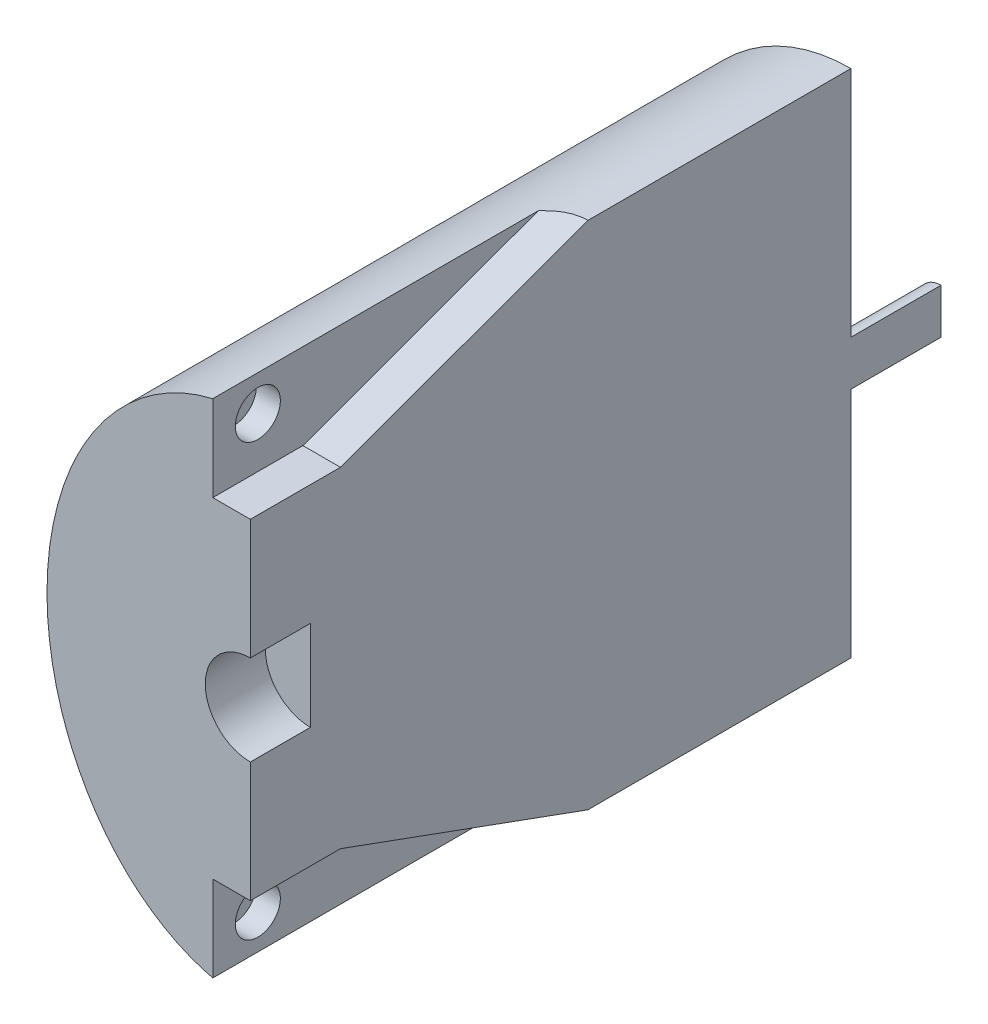
from build123d import *

# Parameters (mm, degrees)
CROQUIS1_RX             = 85
CROQUIS1_RY             = 67.73101263
SALIENTE_EXTRUIR1_DEPTH = 200
CORTAR_EXTRUIR1_DEPTH   = 100
SALIENTE_EXTRUIR2_DEPTH = 30
CROQUIS5_R              = 7.5
SALIENTE_EXTRUIR3_DEPTH = 30
CORTAR_EXTRUIR3_DEPTH   = 30
CROQUIS8_W              = 83.299216536
CROQUIS8_H              = 210.979163193
CORTAR_EXTRUIR4_DEPTH   = 348.816388214
CROQUIS9_R              = 15
CORTAR_EXTRUIR5_DEPTH   = 20
CROQUIS10_R             = 7.5
CORTAR_EXTRUIR6_DEPTH   = 8
CORTAR_EXTRUIR7_DEPTH   = 12.5


with BuildPart() as part:
    # Croquis1 → Saliente-Extruir1 (new body)
    with BuildSketch(Plane.XY):
        with Locations(Location((-119.067557665, 97.160736636), (0, 0, 90))):
            Ellipse(CROQUIS1_RX, CROQUIS1_RY)
    extrude(amount=SALIENTE_EXTRUIR1_DEPTH)

    # Croquis3 → Cortar-Extruir1 (cut)
    with BuildSketch(Plane.XY.offset(200)):
        with BuildLine():
            Line((-171.829854236, 137.159885706), (-171.829854236, 57.159885706))
            Line((-171.829854236, 57.159885706), (-178.829854236, 57.159885706))
            add(Edge.make_bspline(
                [(-178.830577491, 137.159885706), (-195.829371976, 97.159643663), (-178.829854236, 57.159885706)],
                knots=[1.080850346, 1.080850346, 1.080850346, 2.060764999, 2.060764999, 2.060764999], degree=2, weights=[1, 0.882352941, 1]))
            Line((-178.830577491, 137.159885706), (-171.829854236, 137.159885706))
        make_face()
    extrude(amount=-CORTAR_EXTRUIR1_DEPTH, mode=Mode.SUBTRACT)

    # Croquis4 → Saliente-Extruir2 (add)
    with BuildSketch(Plane.XY.offset(200)):
        with BuildLine():
            Line((-178.830577491, 137.159885706), (-171.829854236, 137.159885706))
            Line((-171.829854236, 137.159885706), (-171.829854236, 57.159885706))
            Line((-171.829854236, 57.159885706), (-178.829854236, 57.159885706))
            add(Edge.make_bspline(
                [(-178.830577491, 137.159885706), (-195.797797403, 97.186782087), (-178.829854236, 57.159885706)],
                knots=[4.219557052, 4.219557052, 4.219557052, 5.198274326, 5.198274326, 5.198274326], degree=2, weights=[1, 0.882634519, 1]))
        make_face()
    extrude(amount=-SALIENTE_EXTRUIR2_DEPTH)

    # Croquis5 → Saliente-Extruir3 (add)
    with BuildSketch(Plane(origin=(0, 0, 0), x_dir=(-1, 0, 0), z_dir=(0, 0, -1))):
        with Locations(Location((119.067557665, 97.160736636, 0), (0, 0, 180))):
            Circle(CROQUIS5_R)
    extrude(amount=SALIENTE_EXTRUIR3_DEPTH)

    # Croquis7 → Cortar-Extruir3 (cut)
    with BuildSketch(Plane.XY.offset(200)):
        with BuildLine():
            Line((-131.567557665, 42.160736636), (-106.567557665, 42.160736636))
            Line((-106.567557665, 42.160736636), (-106.567557665, 13.620827843))
            add(Edge.make_bspline(
                [(-131.567557665, 13.620827843), (-119.067557665, 10.675126293), (-106.567557665, 13.620827843)],
                knots=[6.0975677, 6.0975677, 6.0975677, 6.468802915, 6.468802915, 6.468802915], degree=2, weights=[1, 0.982822456, 1]))
            Line((-131.567557665, 13.620827843), (-131.567557665, 42.160736636))
        make_face()
        with BuildLine():
            Line((-131.567557665, 180.700645429), (-131.567557665, 152.160736636))
            Line((-131.567557665, 152.160736636), (-106.567557665, 152.160736636))
            Line((-106.567557665, 152.160736636), (-106.567557665, 180.700645429))
            add(Edge.make_bspline(
                [(-106.567557665, 180.700645429), (-119.067557665, 183.64634698), (-131.567557665, 180.700645429)],
                knots=[2.955975046, 2.955975046, 2.955975046, 3.327210261, 3.327210261, 3.327210261], degree=2, weights=[1, 0.982822456, 1]))
        make_face()
    extrude(amount=-CORTAR_EXTRUIR3_DEPTH, mode=Mode.SUBTRACT)

    # Croquis8 → Cortar-Extruir4 (cut, through all)
    with BuildSketch(Plane.XY.offset(200)):
        with Locations((-77.417949397, 96.990041521)):
            Rectangle(CROQUIS8_W, CROQUIS8_H)
    extrude(amount=-CORTAR_EXTRUIR4_DEPTH, mode=Mode.SUBTRACT)

    # Croquis9 → Cortar-Extruir5 (cut)
    with BuildSketch(Plane.XY.offset(200)):
        with Locations((-119.067557665, 97.160736636)):
            Circle(CROQUIS9_R)
    extrude(amount=-CORTAR_EXTRUIR5_DEPTH, mode=Mode.SUBTRACT)

    # Croquis10 → Cortar-Extruir6 (cut)
    with BuildSketch(Plane(origin=(-131.567557665, 0, 0), x_dir=(0, 0, -1), z_dir=(1, 0, 0))):
        with Locations((-185, 168.930691033)):
            Circle(CROQUIS10_R)
        with Locations((-185, 25.39078224)):
            Circle(CROQUIS10_R)
    extrude(amount=-CORTAR_EXTRUIR6_DEPTH, mode=Mode.SUBTRACT)

    # Croquis11 → Cortar-Extruir7 (cut)
    with BuildSketch(Plane(origin=(-119.067557665, 0, 0), x_dir=(0, 0, -1), z_dir=(1, 0, 0))):
        Polygon((-170, 42.160736636), (-57.236885506, 1.118319437), (-170, -2.441940529), align=None)
        Polygon((-170, 152.160736636), (-58.81920935, 192.627235055), (-170, 211.002181537), align=None)
    extrude(amount=-CORTAR_EXTRUIR7_DEPTH, mode=Mode.SUBTRACT)


solid = part.part
